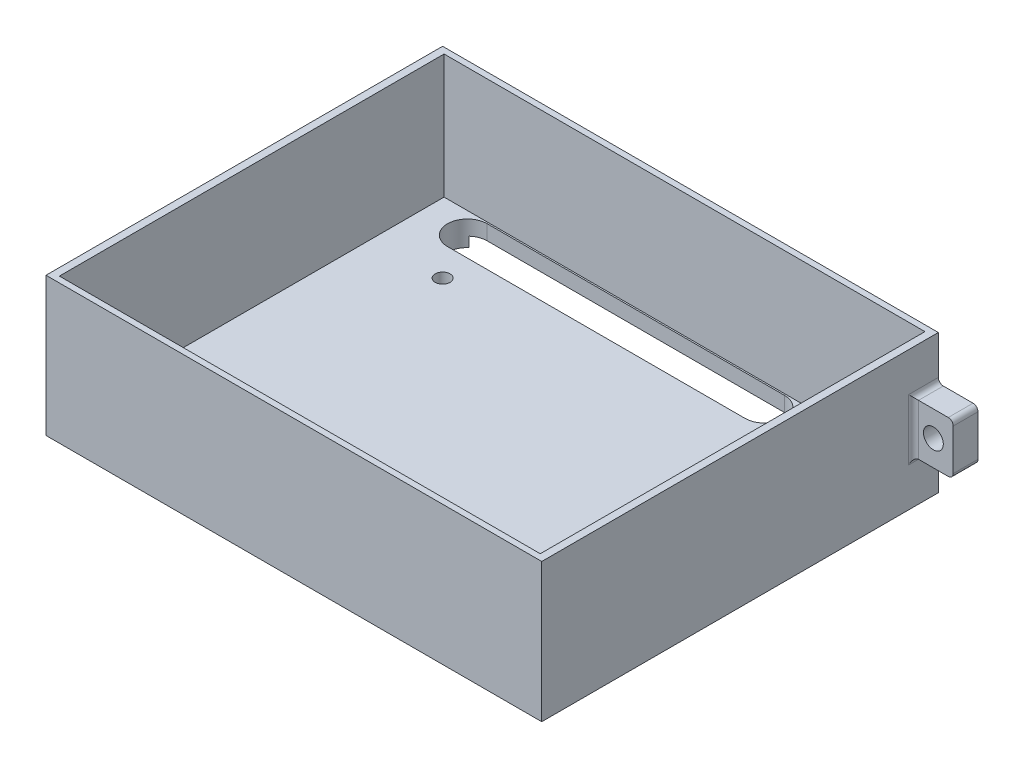
from build123d import *

# Parameters (mm, degrees)
SKETCH1_W           = 100
SKETCH1_H           = 80
BOSS_EXTRUDE1_DEPTH = 3
SKETCH2_W           = 100
SKETCH2_H           = 80
SKETCH2_W_2         = 97
SKETCH2_H_2         = 77.6
BOSS_EXTRUDE2_DEPTH = 25
SKETCH3_R           = 1.5
CUT_EXTRUDE1_DEPTH  = 40
SKETCH4_W           = 95
SKETCH4_H           = 75
BOSS_EXTRUDE3_DEPTH = 5
SKETCH3_2_R         = 1.5
CUT_EXTRUDE2_DEPTH  = 12
SKETCH6_W           = 8
SKETCH6_H           = 10.3
SKETCH6_R           = 2
BOSS_EXTRUDE4_DEPTH = 5
FILLET1_R           = 1
FILLET2_R           = 1
FILLET3_R           = 1
FILLET4_R           = 1
FILLET5_R           = 1
FILLET6_R           = 1
FILLET7_R           = 1
FILLET8_R           = 1
FILLET9_R           = 1
FILLET10_R          = 1


with BuildPart() as part:
    # Sketch1 → Boss-Extrude1 (new body)
    with BuildSketch(Plane(origin=(0, 0, 0), x_dir=(1, 0, 0), z_dir=(0, 1, 0))):
        Rectangle(SKETCH1_W, SKETCH1_H)
    extrude(amount=BOSS_EXTRUDE1_DEPTH)

    # Sketch2 → Boss-Extrude2 (add)
    with BuildSketch(Plane(origin=(0, 3, 0), x_dir=(1, 0, 0), z_dir=(0, 1, 0))):
        Rectangle(SKETCH2_W, SKETCH2_H)
        Rectangle(SKETCH2_W_2, SKETCH2_H_2, mode=Mode.SUBTRACT)
    extrude(amount=BOSS_EXTRUDE2_DEPTH)

    # Sketch3 → Cut-Extrude1 (cut)
    with BuildSketch(Plane(origin=(0, 3, 0), x_dir=(1, 0, 0), z_dir=(0, 1, 0))):
        with Locations((-34.5, 24.5)):
            Circle(SKETCH3_R)
        with Locations((34.5, 24.5)):
            Circle(SKETCH3_R)
        with Locations((-34.5, -24.5)):
            Circle(SKETCH3_R)
        with Locations((34.5, -24.5)):
            Circle(SKETCH3_R)
        with BuildLine():
            Line((-39.5, 38.5), (20.5, 38.5))
            ThreePointArc((20.5, 38.5), (24.5, 34.5), (20.5, 30.5))
            Line((20.5, 30.5), (-39.5, 30.5))
            ThreePointArc((-39.5, 30.5), (-43.5, 34.5), (-39.5, 38.5))
        make_face()
    extrude(amount=-CUT_EXTRUDE1_DEPTH, mode=Mode.SUBTRACT)

    # Sketch4 → Boss-Extrude3 (add)
    with BuildSketch(Plane(origin=(0, 3, 0), x_dir=(1, 0, 0), z_dir=(0, 1, 0))):
        Rectangle(SKETCH4_W, SKETCH4_H)
    extrude(amount=-BOSS_EXTRUDE3_DEPTH)

    # Sketch3<2> → Cut-Extrude2 (cut)
    with BuildSketch(Plane(origin=(0, 3, 0), x_dir=(1, 0, 0), z_dir=(0, 1, 0))):
        with Locations((-34.5, 24.5)):
            Circle(SKETCH3_2_R)
        with Locations((34.5, 24.5)):
            Circle(SKETCH3_2_R)
        with Locations((-34.5, -24.5)):
            Circle(SKETCH3_2_R)
        with Locations((34.5, -24.5)):
            Circle(SKETCH3_2_R)
        with BuildLine():
            Line((-39.5, 38.5), (20.5, 38.5))
            ThreePointArc((20.5, 38.5), (24.5, 34.5), (20.5, 30.5))
            Line((20.5, 30.5), (-39.5, 30.5))
            ThreePointArc((-39.5, 30.5), (-43.5, 34.5), (-39.5, 38.5))
        make_face()
    extrude(amount=-CUT_EXTRUDE2_DEPTH, mode=Mode.SUBTRACT)

    # Sketch6 → Boss-Extrude4 (add)
    # profile 1 of 2: a face of its own
    with BuildSketch(Plane(origin=(0, 0, -40), x_dir=(-1, 0, 0), z_dir=(0, 0, -1))):
        with Locations((-54, 14)):
            Rectangle(SKETCH6_W, SKETCH6_H)
        with Locations((-54, 14)):
            Circle(SKETCH6_R, mode=Mode.SUBTRACT)
    # profile 2 of 2: a face of its own
    with BuildSketch(Plane(origin=(0, 0, -40), x_dir=(-1, 0, 0), z_dir=(0, 0, -1))):
        with Locations((54, 14)):
            Rectangle(SKETCH6_W, SKETCH6_H)
        with Locations((54, 14)):
            Circle(SKETCH6_R, mode=Mode.SUBTRACT)
    extrude(amount=-BOSS_EXTRUDE4_DEPTH)

    # Fillet1
    fillet1_edges = [part.edges().sort_by_distance(p)[0] for p in [
        (50, 8.85, -37.5),
    ]]
    fillet(fillet1_edges, radius=FILLET1_R)

    # Fillet2
    fillet2_edges = [part.edges().sort_by_distance(p)[0] for p in [
        (58, 8.85, -37.5),
    ]]
    fillet(fillet2_edges, radius=FILLET2_R)

    # Fillet3
    fillet3_edges = [part.edges().sort_by_distance(p)[0] for p in [
        (58, 19.15, -37.5),
    ]]
    fillet(fillet3_edges, radius=FILLET3_R)

    # Fillet4
    fillet4_edges = [part.edges().sort_by_distance(p)[0] for p in [
        (50, 19.15, -37.5),
    ]]
    fillet(fillet4_edges, radius=FILLET4_R)

    # Fillet5
    fillet5_edges = [part.edges().sort_by_distance(p)[0] for p in [
        (50, 14, -35),
    ]]
    fillet(fillet5_edges, radius=FILLET5_R)

    # Fillet6
    fillet6_edges = [part.edges().sort_by_distance(p)[0] for p in [
        (-58, 8.85, -37.5),
    ]]
    fillet(fillet6_edges, radius=FILLET6_R)

    # Fillet7
    fillet7_edges = [part.edges().sort_by_distance(p)[0] for p in [
        (-58, 19.15, -37.5),
    ]]
    fillet(fillet7_edges, radius=FILLET7_R)

    # Fillet8
    fillet8_edges = [part.edges().sort_by_distance(p)[0] for p in [
        (-50, 19.15, -37.5),
    ]]
    fillet(fillet8_edges, radius=FILLET8_R)

    # Fillet9
    fillet9_edges = [part.edges().sort_by_distance(p)[0] for p in [
        (-50, 8.85, -37.5),
    ]]
    fillet(fillet9_edges, radius=FILLET9_R)

    # Fillet10
    fillet10_edges = [part.edges().sort_by_distance(p)[0] for p in [
        (-50, 14, -35),
    ]]
    fillet(fillet10_edges, radius=FILLET10_R)


solid = part.part
